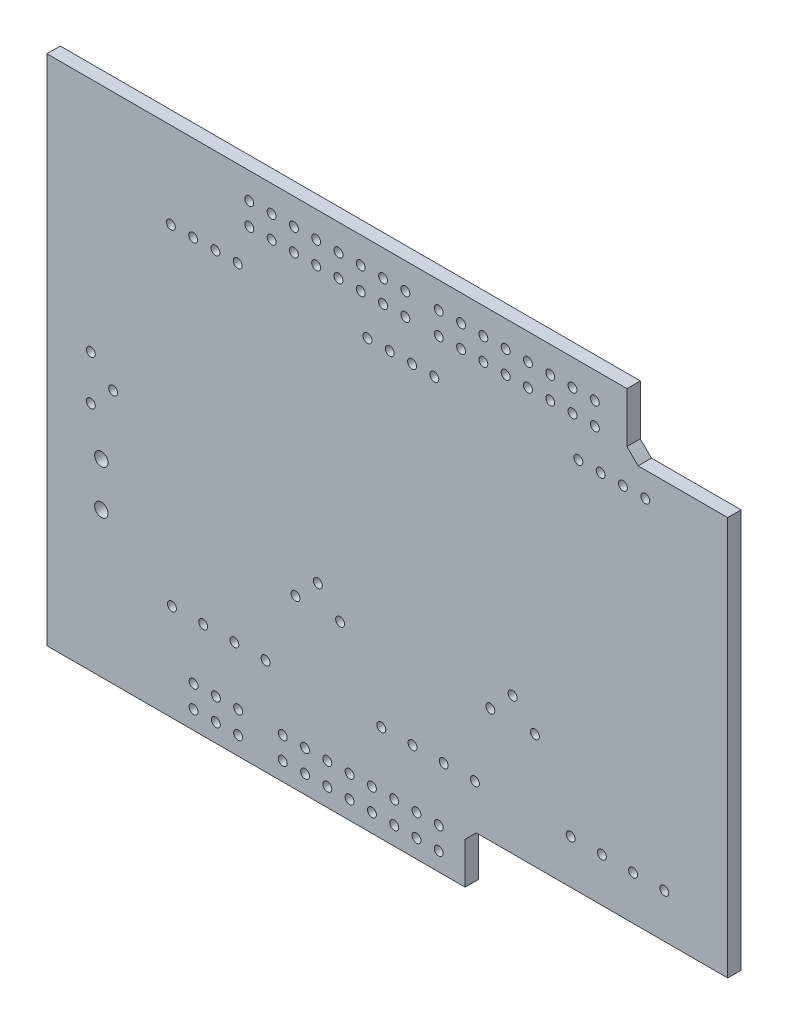
from build123d import *

# Parameters (mm, degrees)
SKETCH1_W           = 77.5716
SKETCH1_H           = 58.42
BOSS_EXTRUDE1_DEPTH = 1.524
SKETCH2_W           = 11.4808
SKETCH2_H           = 6.985
SKETCH2_W_2         = 29.9212
SKETCH2_H_2         = 6
CUT_EXTRUDE1_DEPTH  = 98.121429677
CHAMFER1_SIZE       = 1.27
SKETCH3_R           = 0.508
SKETCH3_R_2         = 0.762
CUT_EXTRUDE2_DEPTH  = 98.121429677


with BuildPart() as part:
    # Sketch1 → Boss-Extrude1 (new body)
    with BuildSketch(Plane.XY):
        with Locations((38.7858, 29.21)):
            Rectangle(SKETCH1_W, SKETCH1_H)
    extrude(amount=BOSS_EXTRUDE1_DEPTH)

    # Sketch2 → Cut-Extrude1 (cut, through all)
    with BuildSketch(Plane.XY.offset(1.524)):
        with Locations((71.8312, 54.9275)):
            Rectangle(SKETCH2_W, SKETCH2_H)
        with Locations((62.611, 3)):
            Rectangle(SKETCH2_W_2, SKETCH2_H_2)
    extrude(amount=-CUT_EXTRUDE1_DEPTH, mode=Mode.SUBTRACT)

    # Chamfer1
    chamfer1_edges = [part.edges().sort_by_distance(p)[0] for p in [
        (66.0908, 51.435, 0.762),
        (47.6504, 6, 0.762),
    ]]
    chamfer(chamfer1_edges, length=CHAMFER1_SIZE)

    # Sketch3 → Cut-Extrude2 (cut, through all)
    with BuildSketch(Plane.XY.offset(1.524)):
        with Locations((62.43, 52.88)):
            Circle(SKETCH3_R)
        with Locations((59.89, 52.88)):
            Circle(SKETCH3_R)
        with Locations((57.35, 52.88)):
            Circle(SKETCH3_R)
        with Locations((54.81, 52.88)):
            Circle(SKETCH3_R)
        with Locations((52.27, 52.88)):
            Circle(SKETCH3_R)
        with Locations((49.73, 52.88)):
            Circle(SKETCH3_R)
        with Locations((47.19, 52.88)):
            Circle(SKETCH3_R)
        with Locations((44.65, 52.88)):
            Circle(SKETCH3_R)
        with Locations((62.43, 55.42)):
            Circle(SKETCH3_R)
        with Locations((59.89, 55.42)):
            Circle(SKETCH3_R)
        with Locations((57.35, 55.42)):
            Circle(SKETCH3_R)
        with Locations((54.81, 55.42)):
            Circle(SKETCH3_R)
        with Locations((52.27, 55.42)):
            Circle(SKETCH3_R)
        with Locations((49.73, 55.42)):
            Circle(SKETCH3_R)
        with Locations((47.19, 55.42)):
            Circle(SKETCH3_R)
        with Locations((44.65, 55.42)):
            Circle(SKETCH3_R)
        with Locations((40.84, 52.88)):
            Circle(SKETCH3_R)
        with Locations((38.3, 52.88)):
            Circle(SKETCH3_R)
        with Locations((35.76, 52.88)):
            Circle(SKETCH3_R)
        with Locations((33.22, 52.88)):
            Circle(SKETCH3_R)
        with Locations((30.68, 52.88)):
            Circle(SKETCH3_R)
        with Locations((28.14, 52.88)):
            Circle(SKETCH3_R)
        with Locations((25.6, 52.88)):
            Circle(SKETCH3_R)
        with Locations((23.06, 52.88)):
            Circle(SKETCH3_R)
        with Locations((38.3, 55.42)):
            Circle(SKETCH3_R)
        with Locations((35.76, 55.42)):
            Circle(SKETCH3_R)
        with Locations((33.22, 55.42)):
            Circle(SKETCH3_R)
        with Locations((30.68, 55.42)):
            Circle(SKETCH3_R)
        with Locations((28.14, 55.42)):
            Circle(SKETCH3_R)
        with Locations((25.6, 55.42)):
            Circle(SKETCH3_R)
        with Locations((23.06, 55.42)):
            Circle(SKETCH3_R)
        with Locations((40.84, 55.42)):
            Circle(SKETCH3_R)
        with Locations((44.650000108, 4.62)):
            Circle(SKETCH3_R)
        with Locations((42.110000108, 4.62)):
            Circle(SKETCH3_R)
        with Locations((39.570000108, 4.62)):
            Circle(SKETCH3_R)
        with Locations((37.030000108, 4.62)):
            Circle(SKETCH3_R)
        with Locations((34.490000108, 4.62)):
            Circle(SKETCH3_R)
        with Locations((31.950000108, 4.62)):
            Circle(SKETCH3_R)
        with Locations((29.410000108, 4.62)):
            Circle(SKETCH3_R)
        with Locations((26.870000108, 4.62)):
            Circle(SKETCH3_R)
        with Locations((21.790000108, 4.62)):
            Circle(SKETCH3_R)
        with Locations((19.250000108, 4.62)):
            Circle(SKETCH3_R)
        with Locations((16.710000108, 4.62)):
            Circle(SKETCH3_R)
        with Locations((42.110000108, 2.08)):
            Circle(SKETCH3_R)
        with Locations((39.570000108, 2.08)):
            Circle(SKETCH3_R)
        with Locations((37.030000108, 2.08)):
            Circle(SKETCH3_R)
        with Locations((34.490000108, 2.08)):
            Circle(SKETCH3_R)
        with Locations((31.950000108, 2.08)):
            Circle(SKETCH3_R)
        with Locations((29.410000108, 2.08)):
            Circle(SKETCH3_R)
        with Locations((26.870000108, 2.08)):
            Circle(SKETCH3_R)
        with Locations((21.790000108, 2.08)):
            Circle(SKETCH3_R)
        with Locations((19.250000108, 2.08)):
            Circle(SKETCH3_R)
        with Locations((16.710000108, 2.08)):
            Circle(SKETCH3_R)
        with Locations((44.650000108, 2.08)):
            Circle(SKETCH3_R)
        with Locations((36.5252, 48.6156)):
            Circle(SKETCH3_R)
        with Locations((60.5536, 48.6156)):
            Circle(SKETCH3_R)
        with Locations((14.1224, 48.6156)):
            Circle(SKETCH3_R)
        with Locations((14.2494, 11.02)):
            Circle(SKETCH3_R)
        with Locations((38.1006, 11.016363144)):
            Circle(SKETCH3_R)
        with Locations((59.6776, 11.016363144)):
            Circle(SKETCH3_R)
        with Locations((6.2018, 21.5208)):
            Circle(SKETCH3_R_2)
        with Locations((6.2018, 16.5208)):
            Circle(SKETCH3_R_2)
        with Locations((63.0936, 48.6156)):
            Circle(SKETCH3_R)
        with Locations((39.0652, 48.6156)):
            Circle(SKETCH3_R)
        with Locations((16.6624, 48.6156)):
            Circle(SKETCH3_R)
        with Locations((65.6336, 48.6156)):
            Circle(SKETCH3_R)
        with Locations((41.6052, 48.6156)):
            Circle(SKETCH3_R)
        with Locations((19.2024, 48.6156)):
            Circle(SKETCH3_R)
        with Locations((68.1736, 48.6156)):
            Circle(SKETCH3_R)
        with Locations((44.1452, 48.6156)):
            Circle(SKETCH3_R)
        with Locations((21.7424, 48.6156)):
            Circle(SKETCH3_R)
        with Locations((17.8054, 11.02)):
            Circle(SKETCH3_R)
        with Locations((41.6566, 11.016363144)):
            Circle(SKETCH3_R)
        with Locations((63.2336, 11.016363144)):
            Circle(SKETCH3_R)
        with Locations((21.3614, 11.02)):
            Circle(SKETCH3_R)
        with Locations((45.2126, 11.016363144)):
            Circle(SKETCH3_R)
        with Locations((66.7896, 11.016363144)):
            Circle(SKETCH3_R)
        with Locations((24.9174, 11.02)):
            Circle(SKETCH3_R)
        with Locations((48.7686, 11.016363144)):
            Circle(SKETCH3_R)
        with Locations((70.3456, 11.016363144)):
            Circle(SKETCH3_R)
        with Locations((55.6026, 19.079)):
            Circle(SKETCH3_R)
        with Locations((50.5226, 19.079)):
            Circle(SKETCH3_R)
        with Locations((53.0626, 21.619)):
            Circle(SKETCH3_R)
        with Locations((30.867, 21.619)):
            Circle(SKETCH3_R)
        with Locations((33.407, 19.079)):
            Circle(SKETCH3_R)
        with Locations((28.327, 19.079)):
            Circle(SKETCH3_R)
        with Locations((5.0018, 26.418)):
            Circle(SKETCH3_R)
        with Locations((7.5418, 28.958)):
            Circle(SKETCH3_R)
        with Locations((5.0018, 31.498)):
            Circle(SKETCH3_R)
    extrude(amount=-CUT_EXTRUDE2_DEPTH, mode=Mode.SUBTRACT)


solid = part.part
